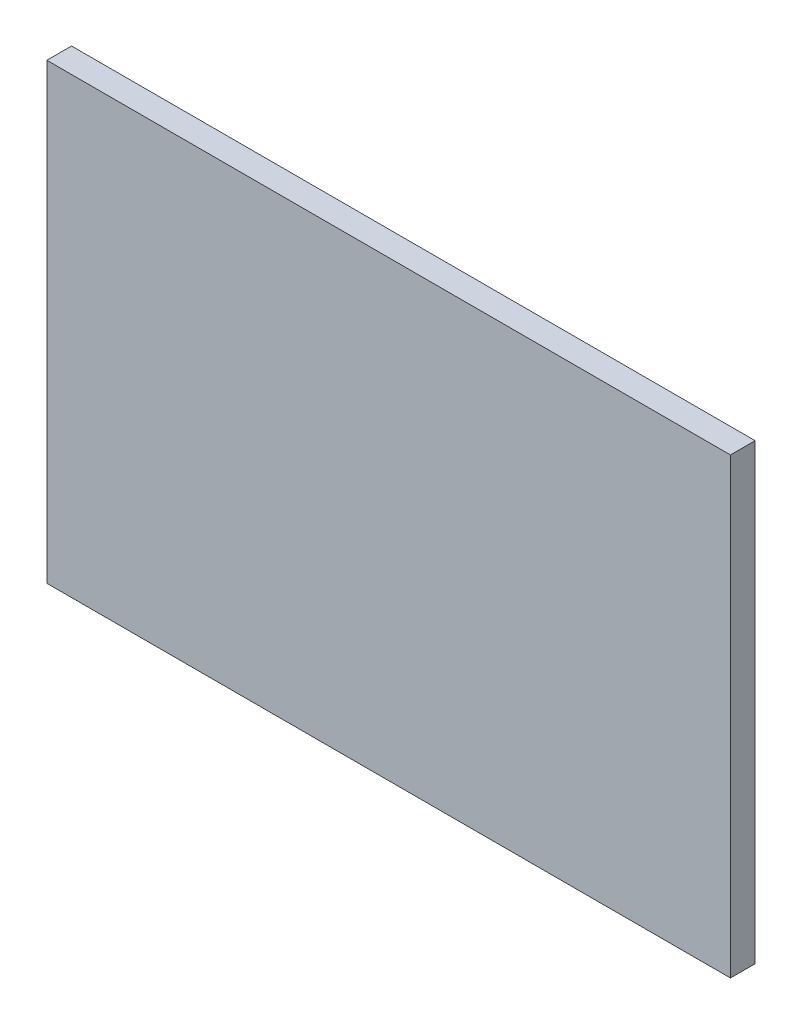
from build123d import *

# Parameters (mm, degrees)
ESQUISSE1_W        = 83
ESQUISSE1_H        = 55
BOSS_EXTRU_1_DEPTH = 3


with BuildPart() as part:
    # Esquisse1 → Boss.-Extru.1 (new body)
    with BuildSketch(Plane.XY):
        with Locations((41.5, 27.5)):
            Rectangle(ESQUISSE1_W, ESQUISSE1_H)
    extrude(amount=BOSS_EXTRU_1_DEPTH)


solid = part.part
